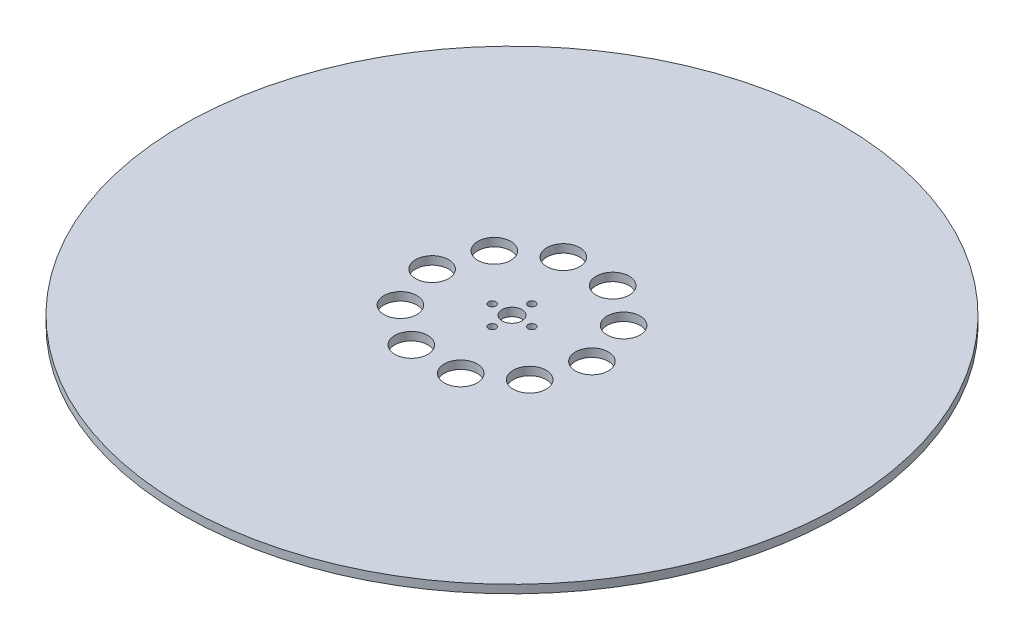
from build123d import *

# Parameters (mm, degrees)
ESQUISSE1_R        = 200
ESQUISSE1_R_2      = 10
ESQUISSE1_R_3      = 2.25
ESQUISSE1_R_4      = 6
BOSS_EXTRU_1_DEPTH = 5


with BuildPart() as part:
    # Esquisse1 → Boss.-Extru.1 (new body)
    with BuildSketch(Plane(origin=(0, 0, 0), x_dir=(1, 0, 0), z_dir=(0, 1, 0))):
        with Locations(Location((0, 0, 0), (0, 0, 270))):
            Circle(ESQUISSE1_R)
        with Locations(Location((-14.985625535, 46.121013002, 0), (0, 0, 270))):
            Circle(ESQUISSE1_R_2, mode=Mode.SUBTRACT)
        with Locations(Location((14.985625535, 46.121013002, 0), (0, 0, 270))):
            Circle(ESQUISSE1_R_2, mode=Mode.SUBTRACT)
        with Locations(Location((39.232876993, 28.504353631, 0), (0, 0, 270))):
            Circle(ESQUISSE1_R_2, mode=Mode.SUBTRACT)
        with Locations(Location((48.494502916, 0, 0), (0, 0, 270))):
            Circle(ESQUISSE1_R_2, mode=Mode.SUBTRACT)
        with Locations(Location((39.232876993, -28.504353631, 0), (0, 0, 270))):
            Circle(ESQUISSE1_R_2, mode=Mode.SUBTRACT)
        with Locations(Location((14.985625535, -46.121013002, 0), (0, 0, 270))):
            Circle(ESQUISSE1_R_2, mode=Mode.SUBTRACT)
        with Locations(Location((-14.985625535, -46.121013002, 0), (0, 0, 270))):
            Circle(ESQUISSE1_R_2, mode=Mode.SUBTRACT)
        with Locations(Location((-39.232876993, -28.504353631, 0), (0, 0, 270))):
            Circle(ESQUISSE1_R_2, mode=Mode.SUBTRACT)
        with Locations(Location((-48.494502916, 0, 0), (0, 0, 270))):
            Circle(ESQUISSE1_R_2, mode=Mode.SUBTRACT)
        with Locations(Location((-39.232876993, 28.504353631, 0), (0, 0, 270))):
            Circle(ESQUISSE1_R_2, mode=Mode.SUBTRACT)
        with Locations(Location((0, 12, 0), (0, 0, 270))):
            Circle(ESQUISSE1_R_3, mode=Mode.SUBTRACT)
        with Locations(Location((0, 0, 0), (0, 0, 270))):
            Circle(ESQUISSE1_R_4, mode=Mode.SUBTRACT)
        with Locations(Location((12, 0, 0), (0, 0, 270))):
            Circle(ESQUISSE1_R_3, mode=Mode.SUBTRACT)
        with Locations(Location((0, -12, 0), (0, 0, 270))):
            Circle(ESQUISSE1_R_3, mode=Mode.SUBTRACT)
        with Locations(Location((-12, 0, 0), (0, 0, 270))):
            Circle(ESQUISSE1_R_3, mode=Mode.SUBTRACT)
    extrude(amount=BOSS_EXTRU_1_DEPTH)


solid = part.part
